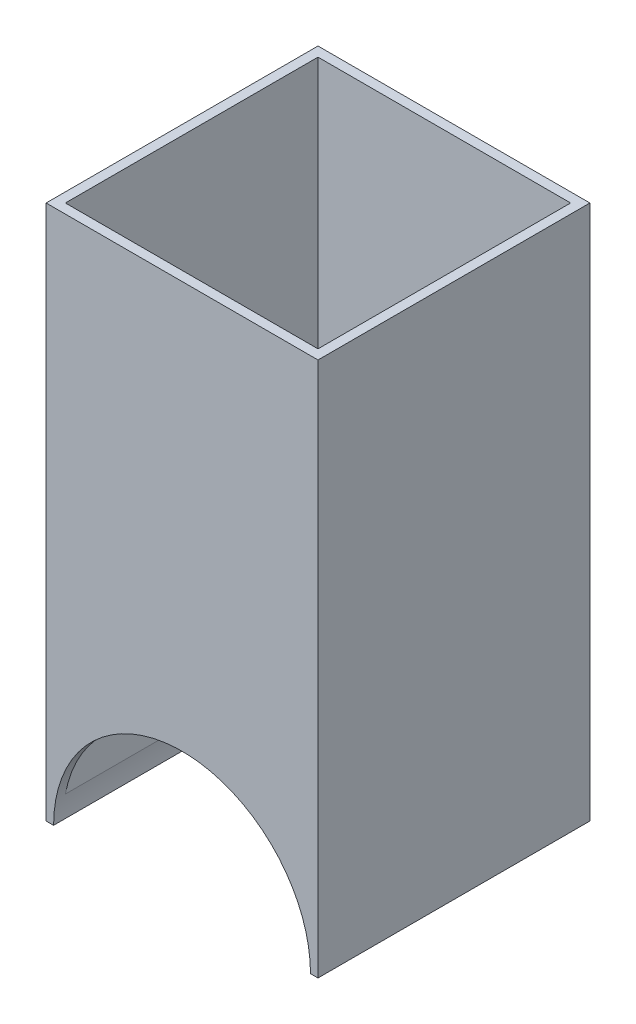
from build123d import *

# Parameters (mm, degrees)
SKETCH1_W           = 25.4
SKETCH1_H           = 25.4
SKETCH1_W_2         = 23.6
SKETCH1_H_2         = 23.6
BOSS_EXTRUDE1_DEPTH = 50
CUT_EXTRUDE1_DEPTH  = 25.4


with BuildPart() as part:
    # Sketch1 → Boss-Extrude1 (new body)
    with BuildSketch(Plane(origin=(0, 0, 0), x_dir=(1, 0, 0), z_dir=(0, 1, 0))):
        Rectangle(SKETCH1_W, SKETCH1_H)
        Rectangle(SKETCH1_W_2, SKETCH1_H_2, mode=Mode.SUBTRACT)
    extrude(amount=BOSS_EXTRUDE1_DEPTH)

    # Sketch2 → Cut-Extrude1 (cut)
    with BuildSketch(Plane.XY.offset(12.7)):
        with BuildLine():
            Line((-12, 0), (12, 0))
            ThreePointArc((12, 0), (0, 12), (-12, 0))
        make_face()
    extrude(amount=-CUT_EXTRUDE1_DEPTH, mode=Mode.SUBTRACT)


solid = part.part
